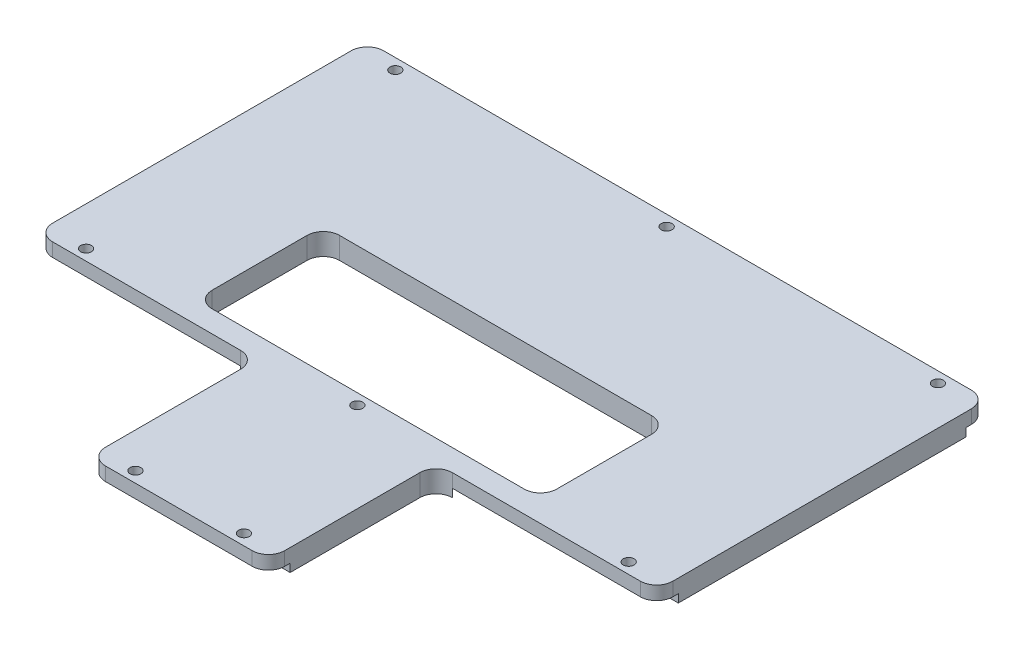
from build123d import *

# Parameters (mm, degrees)
ESQUISSE3_W             = 63.5
ESQUISSE3_H             = 23.468408113
ESQUISSE3_R             = 1
BOSS_EXTRU_1_DEPTH      = 4
CONG_1_R                = 3
ESQUISSE3_3_W           = 114.3
ESQUISSE3_3_H           = 4
ESQUISSE3_3_R           = 1
ESQUISSE3_3_W_2         = 33.02
ENL_V_MAT_EXTRU_1_DEPTH = 1.5


with BuildPart() as part:
    # Esquisse3 → Boss.-Extru.1 (new body)
    with BuildSketch(Plane(origin=(0, 0, 0), x_dir=(1, 0, 0), z_dir=(0, 1, 0))):
        Polygon((-57.15, -30.5), (-16.51, -30.5), (-16.51, -61.4), (16.51, -61.4), (16.51, -30.5), (57.15, -30.5), (57.15, 30.5), (-57.15, 30.5), align=None)
        with Locations((0, -14.765795944)):
            Rectangle(ESQUISSE3_W, ESQUISSE3_H, mode=Mode.SUBTRACT)
        with Locations((50, 28.5)):
            Circle(ESQUISSE3_R, mode=Mode.SUBTRACT)
        with Locations((-50, 28.5)):
            Circle(ESQUISSE3_R, mode=Mode.SUBTRACT)
        with Locations((0, 28.5)):
            Circle(ESQUISSE3_R, mode=Mode.SUBTRACT)
        with Locations((0, -28.5)):
            Circle(ESQUISSE3_R, mode=Mode.SUBTRACT)
        with Locations((50, -28.5)):
            Circle(ESQUISSE3_R, mode=Mode.SUBTRACT)
        with Locations((-50, -28.5)):
            Circle(ESQUISSE3_R, mode=Mode.SUBTRACT)
        with Locations((10, -59.4)):
            Circle(ESQUISSE3_R, mode=Mode.SUBTRACT)
        with Locations((-10, -59.4)):
            Circle(ESQUISSE3_R, mode=Mode.SUBTRACT)
    extrude(amount=BOSS_EXTRU_1_DEPTH)

    # Congé1
    cong_1_edges = [part.edges().sort_by_distance(p)[0] for p in [
        (-57.15, 2, -30.5),
        (57.15, 2, -30.5),
        (57.15, 2, 30.5),
        (16.51, 2, 30.5),
        (16.51, 2, 61.4),
        (-16.51, 2, 61.4),
        (-16.51, 2, 30.5),
        (-57.15, 2, 30.5),
        (-31.75, 2, 3.031591887),
        (31.75, 2, 3.031591887),
        (31.75, 2, 26.5),
        (-31.75, 2, 26.5),
    ]]
    fillet(cong_1_edges, radius=CONG_1_R)

    # Esquisse3<3> → Enlèv. mat.-Extru.1 (cut)
    # profile 1 of 3: a face of its own
    with BuildSketch(Plane(origin=(0, 0, 0), x_dir=(1, 0, 0), z_dir=(0, 1, 0))):
        with Locations((0, -28.5)):
            Rectangle(ESQUISSE3_3_W, ESQUISSE3_3_H)
        with Locations((-50, -28.5)):
            Circle(ESQUISSE3_3_R, mode=Mode.SUBTRACT)
        with Locations((0, -28.5)):
            Circle(ESQUISSE3_3_R, mode=Mode.SUBTRACT)
        with Locations((50, -28.5)):
            Circle(ESQUISSE3_3_R, mode=Mode.SUBTRACT)
    # profile 2 of 3: a face of its own
    with BuildSketch(Plane(origin=(0, 0, 0), x_dir=(1, 0, 0), z_dir=(0, 1, 0))):
        with Locations((0, 28.5)):
            Rectangle(ESQUISSE3_3_W, ESQUISSE3_3_H)
        with Locations((-50, 28.5)):
            Circle(ESQUISSE3_3_R, mode=Mode.SUBTRACT)
        with Locations((0, 28.5)):
            Circle(ESQUISSE3_3_R, mode=Mode.SUBTRACT)
        with Locations((50, 28.5)):
            Circle(ESQUISSE3_3_R, mode=Mode.SUBTRACT)
    # profile 3 of 3: a face of its own
    with BuildSketch(Plane(origin=(0, 0, 0), x_dir=(1, 0, 0), z_dir=(0, 1, 0))):
        with Locations((0, -59.4)):
            Rectangle(ESQUISSE3_3_W_2, ESQUISSE3_3_H)
        with Locations((-10, -59.4)):
            Circle(ESQUISSE3_3_R, mode=Mode.SUBTRACT)
        with Locations((10, -59.4)):
            Circle(ESQUISSE3_3_R, mode=Mode.SUBTRACT)
    extrude(amount=ENL_V_MAT_EXTRU_1_DEPTH, mode=Mode.SUBTRACT)


solid = part.part
